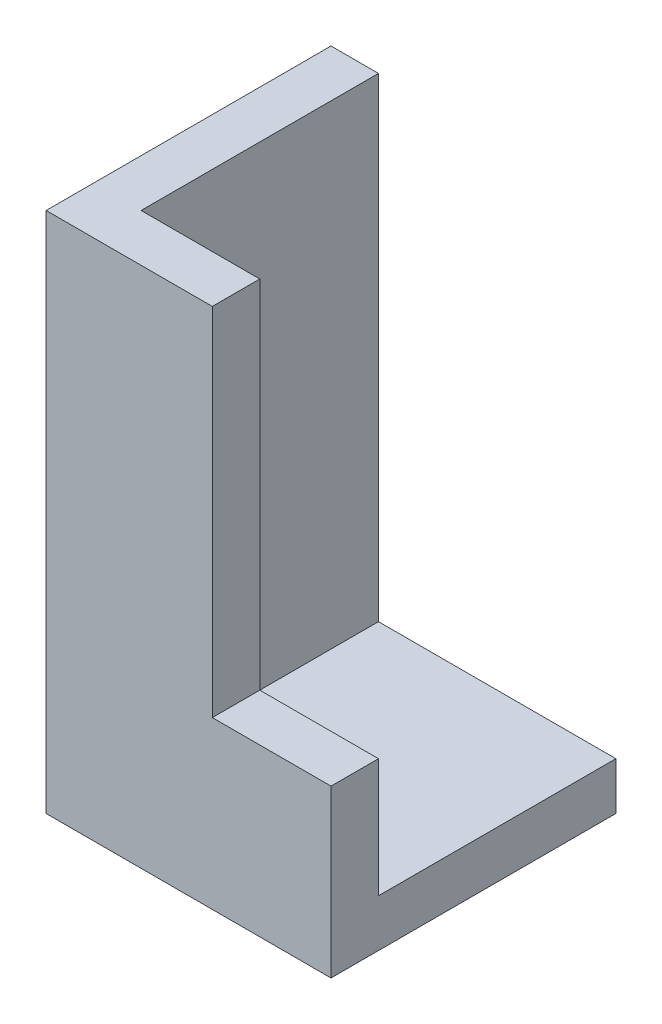
from build123d import *

# Parameters (mm, degrees)
BOSS_EXTRUDE1_DEPTH = 50
BOSS_EXTRUDE2_DEPTH = 10


with BuildPart() as part:
    # Sketch1 → Boss-Extrude1 (new body)
    with BuildSketch(Plane.XY):
        Polygon((0, 110), (10, 110), (10, 10), (60, 10), (60, 0), (0, 0), align=None)
    extrude(amount=BOSS_EXTRUDE1_DEPTH)

    # Sketch2 → Boss-Extrude2 (add)
    with BuildSketch(Plane.XY.offset(50)):
        Polygon((0, 110), (35, 110), (35, 35), (60, 35), (60, 0), (0, 0), align=None)
    extrude(amount=BOSS_EXTRUDE2_DEPTH)


solid = part.part
